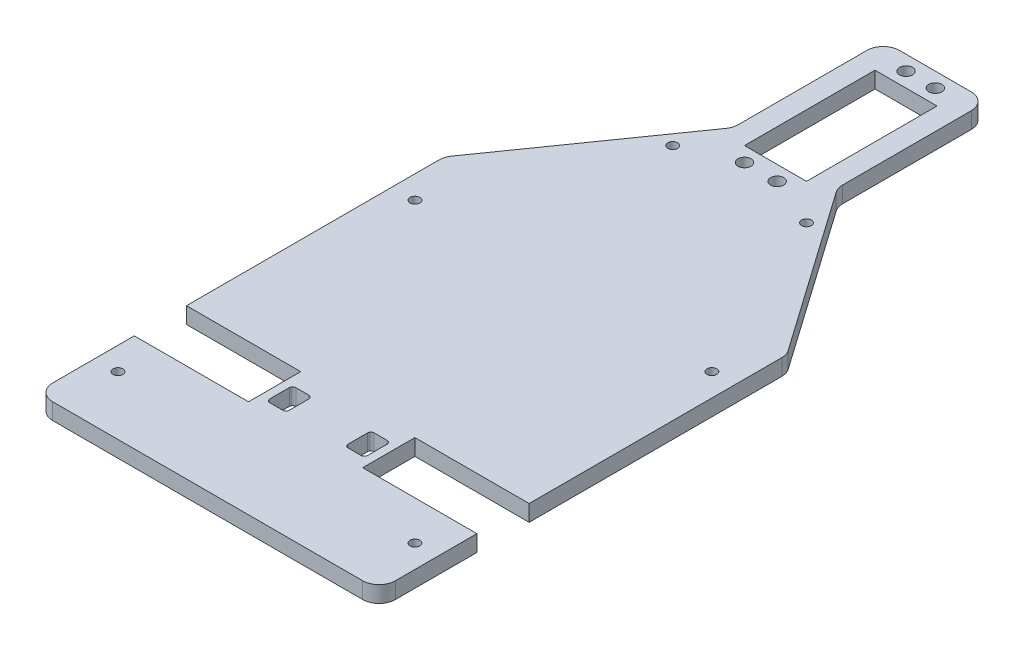
from build123d import *

# Parameters (mm, degrees)
BOSS_EXTRUDE1_DEPTH = 5
SKETCH2_R           = 2
SKETCH2_R_2         = 1.5
SKETCH2_W           = 19
SKETCH2_H           = 40
SKETCH2_W_2         = 35
SKETCH2_H_2         = 16
SKETCH2_W_3         = 6
SKETCH2_H_3         = 8
CUT_EXTRUDE1_DEPTH  = 7
FILLET1_R           = 5
FILLET2_R           = 5
FILLET3_R           = 5
FILLET4_R           = 5
FILLET5_R           = 5
FILLET6_R           = 5
FILLET8_R           = 1
FILLET9_R           = 1
FILLET10_R          = 5


with BuildPart() as part:
    # Sketch1 → Boss-Extrude1 (new body)
    with BuildSketch(Plane(origin=(0, 0, 0), x_dir=(1, 0, 0), z_dir=(0, 1, 0))):
        Polygon((-16, 108), (16, 108), (16, 62), (52.5, 10), (52.5, -115), (-52.5, -115), (-52.5, 10), (-16, 62), align=None)
    extrude(amount=BOSS_EXTRUDE1_DEPTH)

    # Sketch2 → Cut-Extrude1 (cut)
    with BuildSketch(Plane(origin=(0, 5, 0), x_dir=(1, 0, 0), z_dir=(0, 1, 0))):
        with Locations(Location((-4.5, 103.5, 0), (0, 0, 270))):
            Circle(SKETCH2_R)
        with Locations(Location((4.5, 103.5, 0), (0, 0, 270))):
            Circle(SKETCH2_R)
        with Locations(Location((-5, 54.502551087, 0), (0, 0, 270))):
            Circle(SKETCH2_R)
        with Locations(Location((5, 54.502551087, 0), (0, 0, 270))):
            Circle(SKETCH2_R)
        with Locations(Location((-20.5, 48, 0), (0, 0, 270))):
            Circle(SKETCH2_R_2)
        with Locations(Location((20.5, 48, 0), (0, 0, 270))):
            Circle(SKETCH2_R_2)
        with Locations(Location((45.5, -6, 0), (0, 0, 270))):
            Circle(SKETCH2_R_2)
        with Locations(Location((-45.5, -6, 0), (0, 0, 270))):
            Circle(SKETCH2_R_2)
        with Locations(Location((45.5, -97, 0), (0, 0, 270))):
            Circle(SKETCH2_R_2)
        with Locations(Location((-45.5, -97, 0), (0, 0, 270))):
            Circle(SKETCH2_R_2)
        with Locations((0, 79)):
            Rectangle(SKETCH2_W, SKETCH2_H)
        with Locations((-35, -77)):
            Rectangle(SKETCH2_W_2, SKETCH2_H_2)
        with Locations((35, -77)):
            Rectangle(SKETCH2_W_2, SKETCH2_H_2)
        with Locations((-12, -78)):
            Rectangle(SKETCH2_W_3, SKETCH2_H_3)
        with Locations((12, -78)):
            Rectangle(SKETCH2_W_3, SKETCH2_H_3)
    extrude(amount=-CUT_EXTRUDE1_DEPTH, mode=Mode.SUBTRACT)

    # Fillet1
    fillet1_edges = [part.edges().sort_by_distance(p)[0] for p in [
        (16, 2.5, -108),
    ]]
    fillet(fillet1_edges, radius=FILLET1_R)

    # Fillet2
    fillet2_edges = [part.edges().sort_by_distance(p)[0] for p in [
        (-16, 2.5, -108),
    ]]
    fillet(fillet2_edges, radius=FILLET2_R)

    # Fillet3
    fillet3_edges = [part.edges().sort_by_distance(p)[0] for p in [
        (52.5, 2.5, -10),
    ]]
    fillet(fillet3_edges, radius=FILLET3_R)

    # Fillet4
    fillet4_edges = [part.edges().sort_by_distance(p)[0] for p in [
        (-52.5, 2.5, -10),
    ]]
    fillet(fillet4_edges, radius=FILLET4_R)

    # Fillet5
    fillet5_edges = [part.edges().sort_by_distance(p)[0] for p in [
        (52.5, 2.5, 115),
    ]]
    fillet(fillet5_edges, radius=FILLET5_R)

    # Fillet6
    fillet6_edges = [part.edges().sort_by_distance(p)[0] for p in [
        (-52.5, 2.5, 115),
    ]]
    fillet(fillet6_edges, radius=FILLET6_R)

    # Fillet8
    fillet8_edges = [part.edges().sort_by_distance(p)[0] for p in [
        (15, 2.5, 74),
    ]]
    fillet(fillet8_edges, radius=FILLET8_R)

    # Fillet9
    fillet9_edges = [part.edges().sort_by_distance(p)[0] for p in [
        (-15, 2.5, 82),
        (-15, 2.5, 74),
        (-9, 2.5, 74),
        (-9, 2.5, 82),
        (9, 2.5, 74),
        (15, 2.5, 82),
        (9, 2.5, 82),
    ]]
    fillet(fillet9_edges, radius=FILLET9_R)

    # Fillet10
    fillet10_edges = [part.edges().sort_by_distance(p)[0] for p in [
        (16, 2.5, -62),
        (-16, 2.5, -62),
    ]]
    fillet(fillet10_edges, radius=FILLET10_R)


solid = part.part
